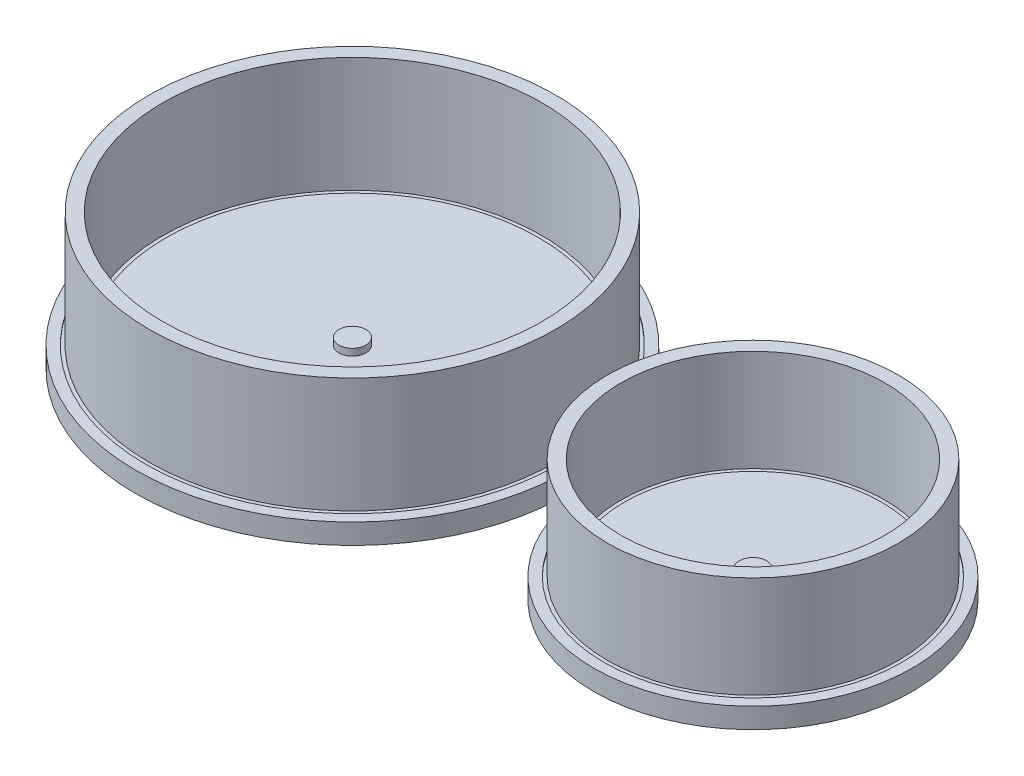
from build123d import *

# Parameters (mm, degrees)
SKETCH_1_R          = 32
EXTRUDE_2_DEPTH     = 3
SKETCH_1_R_2        = 23.5
EXTRUDE_2_2_DEPTH   = 3
SKETCH_5_R          = 30.5
SKETCH_5_R_2        = 27.5
SKETCH_5_R_3        = 22
SKETCH_5_R_4        = 19
CUT_EXTRUDE_2_DEPTH = 0.2
SKETCH_6_R          = 30
SKETCH_6_R_2        = 28
EXTRUDE_5_DEPTH     = 17
SKETCH_6_R_3        = 21.5
SKETCH_6_R_4        = 19.5
EXTRUDE_5_2_DEPTH   = 17
SKETCH_7_R          = 2
EXTRUDE_6_DEPTH     = 1
SKETCH_9_R          = 24.43031199
CUT_EXTRUDE_3_DEPTH = 2


with BuildPart() as part:
    # Эскиз1 → Бобышка-Вытянуть2 (new body)
    with BuildSketch(Plane(origin=(0, 0, 0), x_dir=(1, 0, 0), z_dir=(0, 1, 0))):
        with Locations(Location((0, 0, 0), (0, 0, 270))):
            Circle(SKETCH_1_R)
    extrude(amount=EXTRUDE_2_DEPTH)


with BuildPart() as body_2:
    # Эскиз1 → Extrude 2 2 (new body)
    with BuildSketch(Plane(origin=(0, 0, 0), x_dir=(1, 0, 0), z_dir=(0, 1, 0))):
        with Locations(Location((59.149821763, 0, 0), (0, 0, 270))):
            Circle(SKETCH_1_R_2)
    extrude(amount=EXTRUDE_2_2_DEPTH)


with BuildPart() as cut_extrude_2_tool:
    # Эскиз5 → Вырез-Вытянуть2 (new body)
    # profile 1 of 2: a face of its own
    with BuildSketch(Plane(origin=(0, 3, 0), x_dir=(1, 0, 0), z_dir=(0, 1, 0))):
        with Locations(Location((0, 0, 0), (0, 0, 270))):
            Circle(SKETCH_5_R)
        with Locations(Location((0, 0, 0), (0, 0, 270))):
            Circle(SKETCH_5_R_2, mode=Mode.SUBTRACT)
    # profile 2 of 2: a face of its own
    with BuildSketch(Plane(origin=(0, 3, 0), x_dir=(1, 0, 0), z_dir=(0, 1, 0))):
        with Locations(Location((59.149821763, 0, 0), (0, 0, 270))):
            Circle(SKETCH_5_R_3)
        with Locations(Location((59.149821763, 0, 0), (0, 0, 270))):
            Circle(SKETCH_5_R_4, mode=Mode.SUBTRACT)
    extrude(amount=-CUT_EXTRUDE_2_DEPTH)


with BuildPart() as part_1:
    add(part.part)

    # Вырез-Вытянуть2: cut by cut_extrude_2_tool
    add(cut_extrude_2_tool.part, mode=Mode.SUBTRACT)

    # Эскиз7 → Бобышка-Вытянуть6 (add)
    with BuildSketch(Plane(origin=(0, 3, 0), x_dir=(1, 0, 0), z_dir=(0, 1, 0))):
        with Locations(Location((0, 0, 0), (0, 0, 270))):
            Circle(SKETCH_7_R)
        with Locations(Location((59.149821763, 0, 0), (0, 0, 270))):
            Circle(SKETCH_7_R)
    extrude(amount=EXTRUDE_6_DEPTH)


with BuildPart() as body_2_1:
    add(body_2.part)

    # Вырез-Вытянуть2: cut by cut_extrude_2_tool
    add(cut_extrude_2_tool.part, mode=Mode.SUBTRACT)


with BuildPart() as body_3:
    # Эскиз6 → Бобышка-Вытянуть5 (new body)
    with BuildSketch(Plane(origin=(0, 3, 0), x_dir=(1, 0, 0), z_dir=(0, 1, 0))):
        with Locations(Location((0, 0, 0), (0, 0, 270))):
            Circle(SKETCH_6_R)
        with Locations(Location((0, 0, 0), (0, 0, 270))):
            Circle(SKETCH_6_R_2, mode=Mode.SUBTRACT)
    extrude(amount=EXTRUDE_5_DEPTH)


with BuildPart() as body_4:
    # Эскиз6 → Extrude 5 2 (new body)
    with BuildSketch(Plane(origin=(0, 3, 0), x_dir=(1, 0, 0), z_dir=(0, 1, 0))):
        with Locations(Location((59.149821763, 0, 0), (0, 0, 270))):
            Circle(SKETCH_6_R_3)
        with Locations(Location((59.149821763, 0, 0), (0, 0, 270))):
            Circle(SKETCH_6_R_4, mode=Mode.SUBTRACT)
    extrude(amount=EXTRUDE_5_2_DEPTH)

    # Эскиз9 → Вырез-Вытянуть3 (cut)
    with BuildSketch(Plane(origin=(0, 20, 0), x_dir=(1, 0, 0), z_dir=(0, 1, 0))):
        with Locations((59.149821763, 0)):
            Circle(SKETCH_9_R)
    extrude(amount=-CUT_EXTRUDE_3_DEPTH, mode=Mode.SUBTRACT)


with BuildPart() as extrude_6_piece_1:
    # of the separate pieces the step leaves, piece 1, a body of its own (extrude_6_pieces)
    add(part_1.part.solids().sort_by_distance((0, 0, 32))[0])


with BuildPart() as extrude_6_piece_2:
    # of the separate pieces the step leaves, piece 2, a body of its own (extrude_6_pieces)
    add(part_1.part.solids().sort_by_distance((59.149821763, 3, 2))[0])


solid = Compound([body_2_1.part, body_3.part, body_4.part, extrude_6_piece_1.part, extrude_6_piece_2.part])
